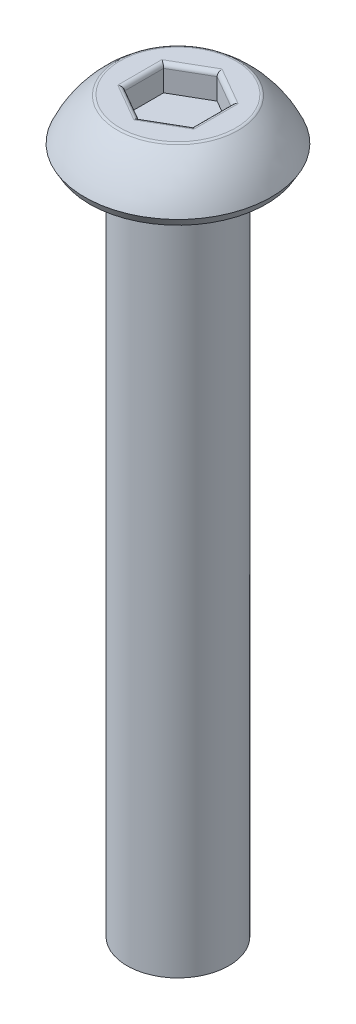
from build123d import *

# Parameters (mm, degrees)
CUT_EXTRUDE1_DEPTH = 0.75
FILLET1_R          = 0.125


with BuildPart() as part:
    # Sketch1 → Revolve1 (revolve)
    with BuildSketch(Plane(origin=(0, 0, 0), x_dir=(0, 0, -1), z_dir=(1, 0, 0)), mode=Mode.PRIVATE) as revolve1_sk:
        with BuildLine():
            Line((0, 1.5), (-1.75, 1.5))
            ThreePointArc((-1.75, 1.5), (-2.334912942, 0.942930354), (-2.75, 0.25))
            Line((-2.75, 0.25), (-2.605662433, 0))
            Line((-2.605662433, 0), (-1.5, 0))
            Line((-1.5, 0), (-1.5, -20))
            Line((-1.5, -20), (0, -20))
            Line((0, -20), (0, 1.5))
        make_face()
    revolve(revolve1_sk.sketch.rotate(Axis((0, -20, 0), (0, 1, 0)), 180), axis=Axis((0, -20, 0), (0, 1, 0)))

    # Sketch2 → Cut-Extrude1 (cut)
    with BuildSketch(Plane(origin=(0, 1.5, 0), x_dir=(1, 0, 0), z_dir=(0, 1, 0))):
        Polygon((0, 1.154700538), (-1, 0.577350269), (-1, -0.577350269), (0, -1.154700538), (1, -0.577350269), (1, 0.577350269), align=None)
    extrude(amount=-CUT_EXTRUDE1_DEPTH, mode=Mode.SUBTRACT)

    # Fillet1
    fillet1_edges = [part.edges().sort_by_distance(p)[0] for p in [
        (0.5, 1.5, -0.866025404),
        (-0.5, 1.5, -0.866025404),
        (-1, 1.5, 0),
        (-0.5, 1.5, 0.866025404),
        (0.5, 1.5, 0.866025404),
        (1, 1.5, 0),
        (0, 1.5, 1.75),
    ]]
    fillet(fillet1_edges, radius=FILLET1_R)


solid = part.part
